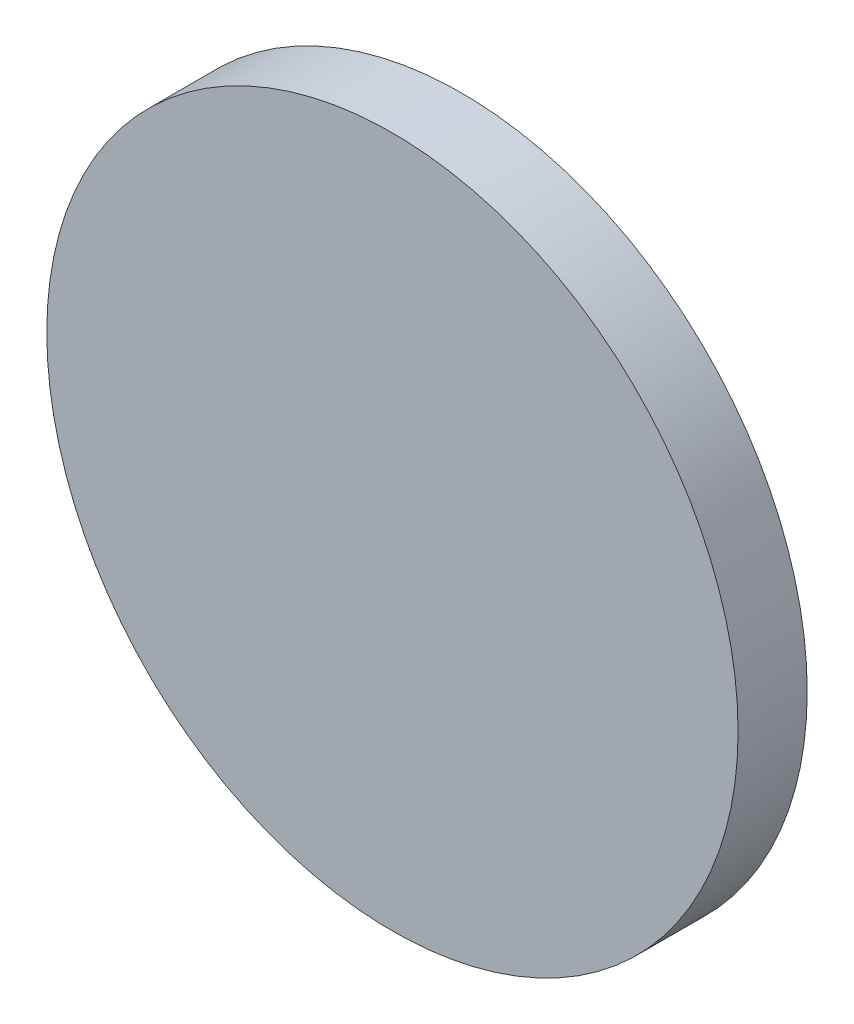
from build123d import *

# Parameters (mm, degrees)
SKETCH_1_R      = 50
EXTRUDE_1_DEPTH = 10


with BuildPart() as part:
    # Эскиз1 → Бобышка-Вытянуть1 (new body)
    with BuildSketch(Plane.XY):
        Circle(SKETCH_1_R)
    extrude(amount=EXTRUDE_1_DEPTH)


solid = part.part
